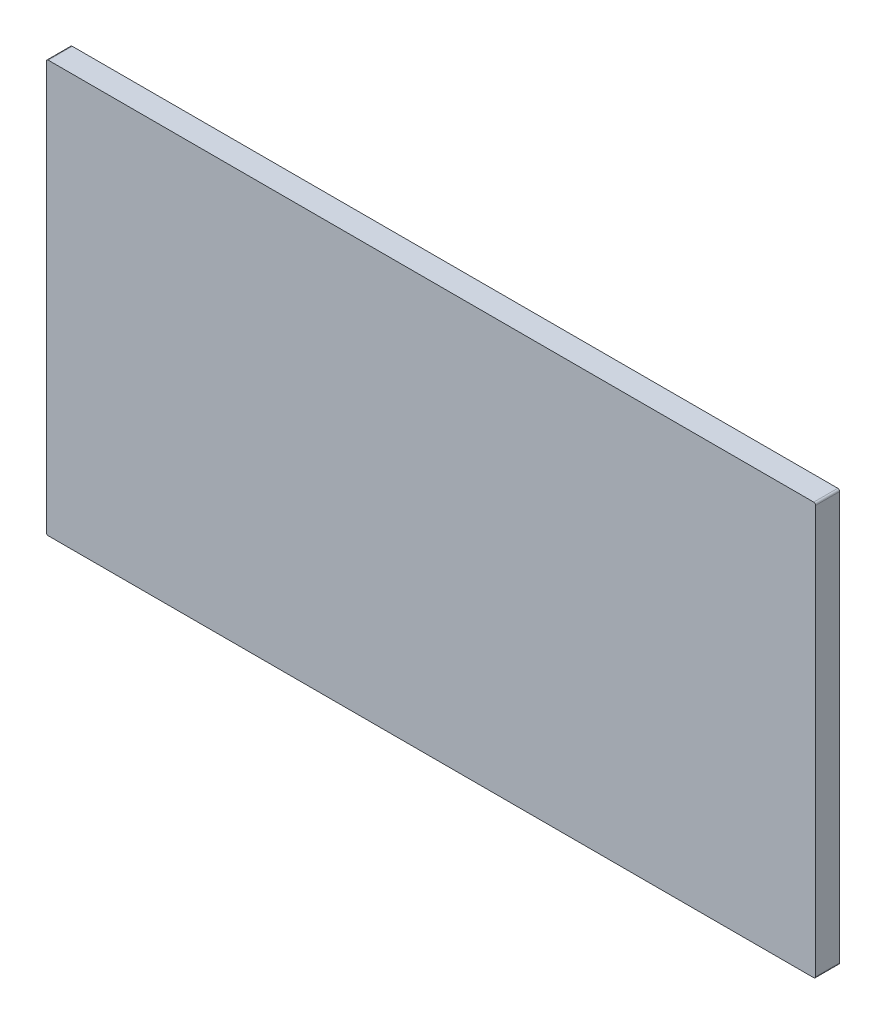
from build123d import *

# Parameters (mm, degrees)
SKETCH1_W           = 609.6
SKETCH1_H           = 326.39
BOSS_EXTRUDE1_DEPTH = 9.525
FILLET2_R           = 1.5


with BuildPart() as part:
    # Sketch1 → Boss-Extrude1 (new, symmetric)
    with BuildSketch(Plane.XY):
        Rectangle(SKETCH1_W, SKETCH1_H)
    extrude(amount=BOSS_EXTRUDE1_DEPTH, both=True)

    # Fillet2
    fillet2_edges = [part.edges().sort_by_distance(p)[0] for p in [
        (-304.8, 163.195, 0),
        (304.8, 163.195, 0),
        (304.8, -163.195, 0),
        (-304.8, -163.195, 0),
    ]]
    fillet(fillet2_edges, radius=FILLET2_R)


solid = part.part
